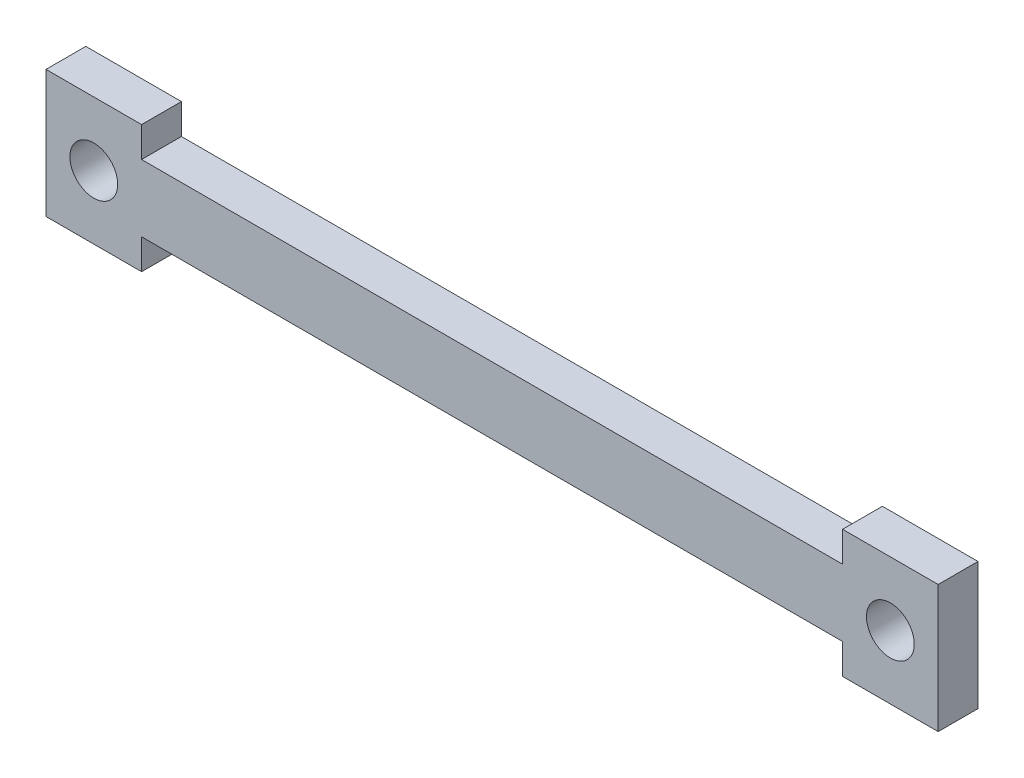
from build123d import *

# Parameters (mm, degrees)
EXTRUDE_1_DEPTH     = 2.5
SKETCH_2_R          = 1.5
CUT_EXTRUDE_1_DEPTH = 2.5


with BuildPart() as part:
    # Эскиз1 → Бобышка-Вытянуть1 (new body)
    with BuildSketch(Plane.XY):
        Polygon((-28, 4), (-22, 4), (-22, 2.1), (22, 2.1), (22, 4), (28, 4), (28, -4), (22, -4), (22, -2.1), (-22, -2.1), (-22, -4), (-28, -4), align=None)
    extrude(amount=EXTRUDE_1_DEPTH)

    # Эскиз2 → Вырез-Вытянуть1 (cut)
    with BuildSketch(Plane.XY.offset(2.5)):
        with Locations((-25, 0)):
            Circle(SKETCH_2_R)
        with Locations(Location((25, 0, 0), (0, 0, 180))):
            Circle(SKETCH_2_R)
    extrude(amount=-CUT_EXTRUDE_1_DEPTH, mode=Mode.SUBTRACT)


solid = part.part
